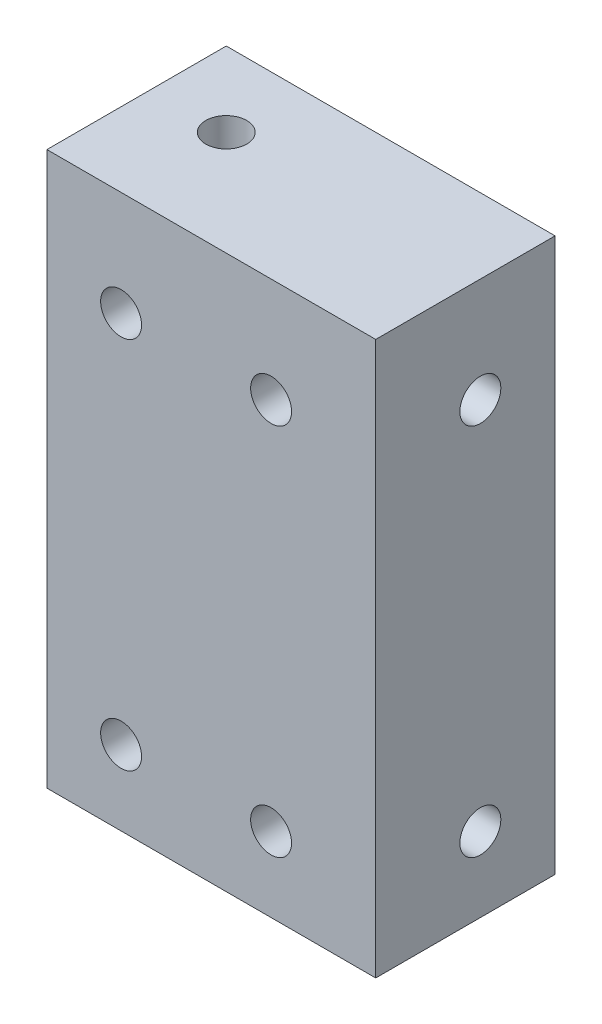
from build123d import *

# Parameters (mm, degrees)
SKETCH1_W           = 40
SKETCH1_H           = 70
SKETCH1_R           = 2.74
BOSS_EXTRUDE1_DEPTH = 4
SKETCH2_W           = 40
SKETCH2_H           = 24
SKETCH2_R           = 2.74
BOSS_EXTRUDE2_DEPTH = 4
SKETCH3_W           = 24
SKETCH3_H           = 74
SKETCH3_R           = 2.74
BOSS_EXTRUDE3_DEPTH = 4


with BuildPart() as part:
    # Sketch1 → Boss-Extrude1 (new body)
    with BuildSketch(Plane.XY):
        with Locations((-209.068179547, -486.277483232)):
            Rectangle(SKETCH1_W, SKETCH1_H)
        with Locations((-199.068179547, -461.277483232)):
            Circle(SKETCH1_R, mode=Mode.SUBTRACT)
        with Locations((-219.139101533, -461.277483232)):
            Circle(SKETCH1_R, mode=Mode.SUBTRACT)
        with Locations((-219.139101533, -511.277483232)):
            Circle(SKETCH1_R, mode=Mode.SUBTRACT)
        with Locations((-199.068179547, -511.277483232)):
            Circle(SKETCH1_R, mode=Mode.SUBTRACT)
    extrude(amount=BOSS_EXTRUDE1_DEPTH)

    # Sketch2 → Boss-Extrude2 (add)
    with BuildSketch(Plane(origin=(0, -451.277483232, 0), x_dir=(1, 0, 0), z_dir=(0, 1, 0))):
        with Locations((-209.068179547, 8)):
            Rectangle(SKETCH2_W, SKETCH2_H)
        with Locations(Location((-219.068179547, 10, 0), (0, 0, 270))):
            Circle(SKETCH2_R, mode=Mode.SUBTRACT)
    extrude(amount=BOSS_EXTRUDE2_DEPTH)

    # Sketch3 → Boss-Extrude3 (add)
    with BuildSketch(Plane(origin=(-189.068179547, 0, 0), x_dir=(0, 0, -1), z_dir=(1, 0, 0))):
        with Locations((8, -484.277483232)):
            Rectangle(SKETCH3_W, SKETCH3_H)
        with Locations((10, -461.277483232)):
            Circle(SKETCH3_R, mode=Mode.SUBTRACT)
        with Locations((10, -511.277483232)):
            Circle(SKETCH3_R, mode=Mode.SUBTRACT)
    extrude(amount=BOSS_EXTRUDE3_DEPTH)


solid = part.part
